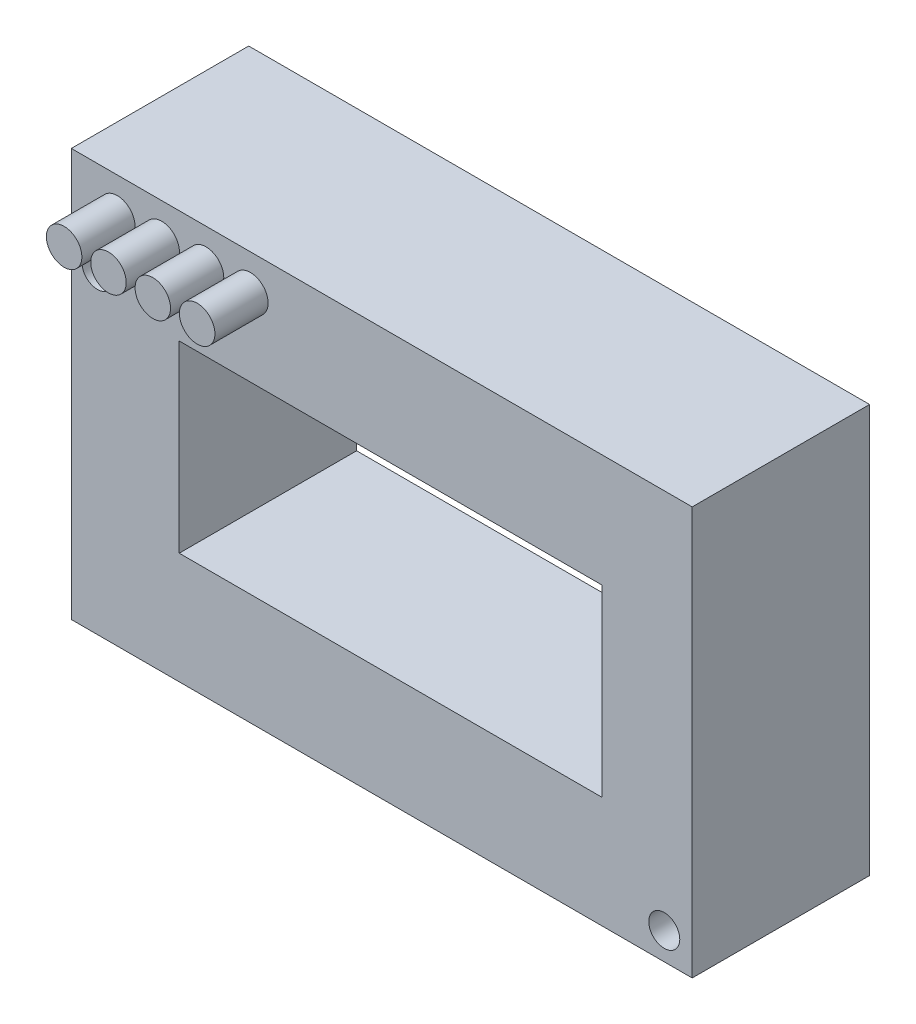
from build123d import *

# Parameters (mm, degrees)
SKETCH_1_W          = 35
SKETCH_1_H          = 23
EXTRUDE_1_DEPTH     = 10
SKETCH_2_W          = 23.830576701
SKETCH_2_H          = 10.361120305
CUT_EXTRUDE_1_DEPTH = 10
CUT_EXTRUDE_2_REACH = 27.1
SKETCH_3_R          = 0.875
SKETCH_4_R          = 1
EXTRUDE_2_DEPTH     = 3


with BuildPart() as part:
    # 草圖1 → 填料-伸長1 (new body)
    with BuildSketch(Plane.XY):
        with Locations((-0.640978345, -2.673693694)):
            Rectangle(SKETCH_1_W, SKETCH_1_H)
    extrude(amount=EXTRUDE_1_DEPTH)

    # 草圖2 → 除料-伸長1 (cut)
    with BuildSketch(Plane.XY.offset(10)):
        with Locations((-0.14284756, -2.713544157)):
            Rectangle(SKETCH_2_W, SKETCH_2_H)
    extrude(amount=-CUT_EXTRUDE_1_DEPTH, mode=Mode.SUBTRACT)

    # 草圖3 → 除料-伸長2 (cut, up to next)
    with BuildSketch(Plane.XY.offset(10), mode=Mode.PRIVATE) as cut_extrude_2_sk1:
        with Locations((-16.665978345, 3.551306306)):
            Circle(SKETCH_3_R)
    cut_extrude_2_tool1 = extrude(cut_extrude_2_sk1.sketch, amount=-CUT_EXTRUDE_2_REACH, mode=Mode.PRIVATE) & part.part
    # 草圖3 → 除料-伸長2 (cut, up to next)
    with BuildSketch(Plane.XY.offset(10), mode=Mode.PRIVATE) as cut_extrude_2_sk2:
        with Locations((15.284021655, -12.638693694)):
            Circle(SKETCH_3_R)
    cut_extrude_2_tool2 = extrude(cut_extrude_2_sk2.sketch, amount=-CUT_EXTRUDE_2_REACH, mode=Mode.PRIVATE) & part.part
    add(cut_extrude_2_tool1.solids().sort_by_distance((-16.665978, 3.551306, 10))[0], mode=Mode.SUBTRACT)
    add(cut_extrude_2_tool2.solids().sort_by_distance((15.284022, -12.638694, 10))[0], mode=Mode.SUBTRACT)

    # 草圖4 → 填料-伸長2 (add)
    with BuildSketch(Plane.XY.offset(10)):
        with Locations((-15.547323348, 6.81929444)):
            Circle(SKETCH_4_R)
        with Locations((-13.047323348, 6.81929444)):
            Circle(SKETCH_4_R)
        with Locations((-10.547323348, 6.81929444)):
            Circle(SKETCH_4_R)
        with Locations((-8.047323348, 6.81929444)):
            Circle(SKETCH_4_R)
    extrude(amount=EXTRUDE_2_DEPTH)


solid = part.part
